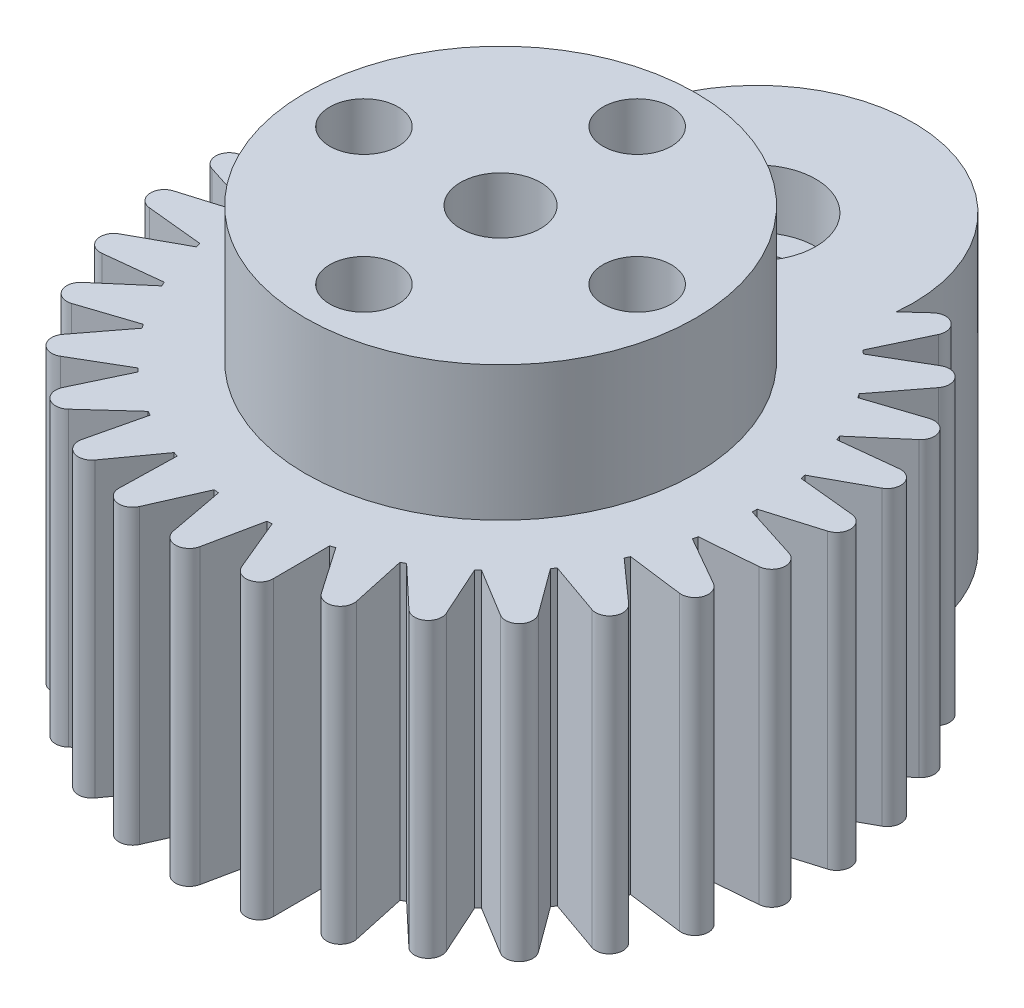
from build123d import *

# Parameters (mm, degrees)
SKETCH_1_R          = 2.05
SKETCH_1_R_2        = 1.75
EXTRUDE_1_DEPTH     = 15
SKETCH_2_R          = 10
SKETCH_2_R_2        = 1.75
SKETCH_2_R_3        = 2.05
EXTRUDE_2_DEPTH     = 6.9
SKETCH_3_R          = 8
SKETCH_3_R_2        = 1.75
EXTRUDE_3_DEPTH     = 15
CUT_EXTRUDE_1_DEPTH = 7.5
SKETCH_5_R          = 1.65
CUT_EXTRUDE_2_DEPTH = 7.5
SKETCH_6_R          = 3
CUT_EXTRUDE_3_DEPTH = 3


with BuildPart() as part:
    # 草图1 → 凸台-拉伸1 (new body)
    with BuildSketch(Plane(origin=(0, 0, 0), x_dir=(1, 0, 0), z_dir=(0, 1, 0))):
        with BuildLine():
            Line((13.15, 0), (15.928328767, 0.831197488))
            ThreePointArc((15.928328767, 0.831197488), (16.42452517, 1.568368494), (15.797783898, 2.198310824))
            Line((15.797783898, 2.198310824), (12.912357414, 2.48867957))
            ThreePointArc((12.912357414, 2.48867957), (12.888083079, 2.611477465), (12.86264095, 2.734038734))
            Line((12.86264095, 2.734038734), (15.407440892, 4.124719594))
            ThreePointArc((15.407440892, 4.124719594), (15.739527743, 4.948946678), (14.995509896, 5.43481642))
            Line((14.995509896, 5.43481642), (12.112765847, 5.118926013))
            ThreePointArc((12.112765847, 5.118926013), (12.063490846, 5.233993562), (12.013122768, 5.348586856))
            Line((12.013122768, 5.348586856), (14.213173917, 7.237971662))
            ThreePointArc((14.213173917, 7.237971662), (14.366637427, 8.113232145), (13.537860156, 8.433794459))
            Line((13.537860156, 8.433794459), (10.783788289, 7.525450826))
            ThreePointArc((10.783788289, 7.525450826), (10.711666177, 7.627759024), (10.638573476, 7.729376068))
            Line((10.638573476, 7.729376068), (12.397723039, 10.034889636))
            ThreePointArc((12.397723039, 10.034889636), (12.365856116, 10.922930435), (11.488540964, 11.06417521))
            Line((11.488540964, 11.06417521), (8.983507437, 9.603077326))
            ThreePointArc((8.983507437, 9.603077326), (8.891690295, 9.688154814), (8.799067474, 9.772354455))
            Line((8.799067474, 9.772354455), (10.040432174, 12.393234781))
            ThreePointArc((10.040432174, 12.393234781), (9.824627556, 13.255244252), (8.937117405, 13.210998413))
            Line((8.937117405, 13.210998413), (6.790604202, 11.261003267))
            ThreePointArc((6.790604202, 11.261003267), (6.68310488, 11.32513175), (6.575, 11.38823406))
            Line((6.575, 11.38823406), (7.244326243, 14.209936096))
            ThreePointArc((7.244326243, 14.209936096), (6.854015627, 15.008240289), (5.99509893, 14.780437591))
            Line((5.99509893, 14.780437591), (4.300918978, 12.426769329))
            ThreePointArc((4.300918978, 12.426769329), (4.182435713, 12.467146085), (4.063573476, 12.506393189))
            Line((4.063573476, 12.506393189), (4.131608494, 15.405595017))
            ThreePointArc((4.131608494, 15.405595017), (3.583850326, 16.105304208), (2.791065864, 15.703900723))
            Line((2.791065864, 15.703900723), (1.623262957, 13.04942594))
            ThreePointArc((1.623262957, 13.04942594), (1.498974036, 13.064286312), (1.374549292, 13.077962924))
            Line((1.374549292, 13.077962924), (0.838319627, 15.927955511))
            ThreePointArc((0.838319627, 15.927955511), (0.157053569, 16.498489051), (-0.534950174, 15.941028037))
            Line((-0.534950174, 15.941028037), (-1.125337445, 13.10176002))
            ThreePointArc((-1.125337445, 13.10176002), (-1.25, 13.090454538), (-1.374549292, 13.077962924))
            Line((-1.374549292, 13.077962924), (-2.49160783, 15.754187919))
            ThreePointArc((-2.49160783, 15.754187919), (-3.276607183, 16.170610754), (-3.837586321, 15.481455933))
            Line((-3.837586321, 15.481455933), (-3.8247552, 12.581484318))
            ThreePointArc((-3.8247552, 12.581484318), (-3.944343037, 12.544507085), (-4.063573476, 12.506393189))
            Line((-4.063573476, 12.506393189), (-5.712640068, 14.891886718))
            ThreePointArc((-5.712640068, 14.891886718), (-6.567064478, 15.135999172), (-6.972501532, 14.345269916))
            Line((-6.972501532, 14.345269916), (-6.3570128, 11.511337379))
            ThreePointArc((-6.3570128, 11.511337379), (-6.466299357, 11.450304477), (-6.575, 11.38823406))
            Line((-6.575, 11.38823406), (-8.684002523, 13.378738608))
            ThreePointArc((-8.684002523, 13.378738608), (-9.570509543, 13.439871795), (-9.802684968, 12.582126767))
            Line((-9.802684968, 12.582126767), (-8.611438437, 9.938089759))
            ThreePointArc((-8.611438437, 9.938089759), (-8.705647366, 9.85566862), (-8.799067474, 9.772354455))
            Line((-8.799067474, 9.772354455), (-11.275832398, 11.280875422))
            ThreePointArc((-11.275832398, 11.280875422), (-12.155677416, 11.15635753), (-12.204444033, 10.269084303))
            Line((-12.204444033, 10.269084303), (-10.489502891, 7.930499928))
            ThreePointArc((-10.489502891, 7.930499928), (-10.564516811, 7.83029275), (-10.638573476, 7.729376068))
            Line((-10.638573476, 7.729376068), (-13.374854289, 8.689983849))
            ThreePointArc((-13.374854289, 8.689983849), (-14.209583858, 8.385256906), (-14.072810329, 7.507233578))
            Line((-14.072810329, 7.507233578), (-11.909125735, 5.576309195))
            ThreePointArc((-11.909125735, 5.576309195), (-11.961666177, 5.462695514), (-12.013122768, 5.348586856))
            Line((-12.013122768, 5.348586856), (-14.889330869, 5.719298283))
            ThreePointArc((-14.889330869, 5.719298283), (-15.642463299, 5.247680319), (-15.326127286, 4.417280723))
            Line((-15.326127286, 4.417280723), (-12.808262637, 2.978406992))
            ThreePointArc((-12.808262637, 2.978406992), (-12.836033332, 2.856352271), (-12.86264095, 2.734038734))
            Line((-12.86264095, 2.734038734), (-15.753072242, 2.498651937))
            ThreePointArc((-15.753072242, 2.498651937), (-16.391692033, 1.88075492), (-15.909618937, 1.134271503))
            Line((-15.909618937, 1.134271503), (-13.147617002, 0.250334112))
            ThreePointArc((-13.147617002, 0.250334112), (-13.149404237, 0.125172727), (-13.15, 0))
            Line((-13.15, 0), (-15.928328767, -0.831197488))
            ThreePointArc((-15.928328767, -0.831197488), (-16.42452517, -1.568368494), (-15.797783898, -2.198310824))
            Line((-15.797783898, -2.198310824), (-12.912357414, -2.48867957))
            ThreePointArc((-12.912357414, -2.48867957), (-12.888083079, -2.611477465), (-12.86264095, -2.734038734))
            Line((-12.86264095, -2.734038734), (-15.407440892, -4.124719594))
            ThreePointArc((-15.407440892, -4.124719594), (-15.739527743, -4.948946678), (-14.995509896, -5.43481642))
            Line((-14.995509896, -5.43481642), (-12.112765847, -5.118926013))
            ThreePointArc((-12.112765847, -5.118926013), (-12.063490846, -5.233993562), (-12.013122768, -5.348586856))
            Line((-12.013122768, -5.348586856), (-14.213173917, -7.237971662))
            ThreePointArc((-14.213173917, -7.237971662), (-14.366637427, -8.113232145), (-13.537860156, -8.433794459))
            Line((-13.537860156, -8.433794459), (-10.783788289, -7.525450826))
            ThreePointArc((-10.783788289, -7.525450826), (-10.711666177, -7.627759024), (-10.638573476, -7.729376068))
            Line((-10.638573476, -7.729376068), (-12.397723039, -10.034889636))
            ThreePointArc((-12.397723039, -10.034889636), (-12.365856116, -10.922930435), (-11.488540964, -11.06417521))
            Line((-11.488540964, -11.06417521), (-8.983507437, -9.603077326))
            ThreePointArc((-8.983507437, -9.603077326), (-8.891690295, -9.688154814), (-8.799067474, -9.772354455))
            Line((-8.799067474, -9.772354455), (-10.040432174, -12.393234781))
            ThreePointArc((-10.040432174, -12.393234781), (-9.824627556, -13.255244252), (-8.937117405, -13.210998413))
            Line((-8.937117405, -13.210998413), (-6.790604202, -11.261003267))
            ThreePointArc((-6.790604202, -11.261003267), (-6.68310488, -11.32513175), (-6.575, -11.38823406))
            Line((-6.575, -11.38823406), (-7.244326243, -14.209936096))
            ThreePointArc((-7.244326243, -14.209936096), (-6.854015627, -15.008240289), (-5.99509893, -14.780437591))
            Line((-5.99509893, -14.780437591), (-4.300918978, -12.426769329))
            ThreePointArc((-4.300918978, -12.426769329), (-4.182435713, -12.467146085), (-4.063573476, -12.506393189))
            Line((-4.063573476, -12.506393189), (-4.131608494, -15.405595017))
            ThreePointArc((-4.131608494, -15.405595017), (-3.583850326, -16.105304208), (-2.791065864, -15.703900723))
            Line((-2.791065864, -15.703900723), (-1.623262957, -13.04942594))
            ThreePointArc((-1.623262957, -13.04942594), (-1.498974036, -13.064286312), (-1.374549292, -13.077962924))
            Line((-1.374549292, -13.077962924), (-0.838319627, -15.927955511))
            ThreePointArc((-0.838319627, -15.927955511), (-0.157053569, -16.498489051), (0.534950174, -15.941028037))
            Line((0.534950174, -15.941028037), (1.125337445, -13.10176002))
            ThreePointArc((1.125337445, -13.10176002), (1.25, -13.090454538), (1.374549292, -13.077962924))
            Line((1.374549292, -13.077962924), (2.49160783, -15.754187919))
            ThreePointArc((2.49160783, -15.754187919), (3.276607183, -16.170610754), (3.837586321, -15.481455933))
            Line((3.837586321, -15.481455933), (3.8247552, -12.581484318))
            ThreePointArc((3.8247552, -12.581484318), (3.944343037, -12.544507085), (4.063573476, -12.506393189))
            Line((4.063573476, -12.506393189), (5.712640068, -14.891886718))
            ThreePointArc((5.712640068, -14.891886718), (6.567064478, -15.135999172), (6.972501532, -14.345269916))
            Line((6.972501532, -14.345269916), (6.3570128, -11.511337379))
            ThreePointArc((6.3570128, -11.511337379), (6.466299357, -11.450304477), (6.575, -11.38823406))
            Line((6.575, -11.38823406), (8.684002523, -13.378738608))
            ThreePointArc((8.684002523, -13.378738608), (9.570509543, -13.439871795), (9.802684968, -12.582126767))
            Line((9.802684968, -12.582126767), (8.611438437, -9.938089759))
            ThreePointArc((8.611438437, -9.938089759), (8.705647366, -9.85566862), (8.799067474, -9.772354455))
            Line((8.799067474, -9.772354455), (11.275832398, -11.280875422))
            ThreePointArc((11.275832398, -11.280875422), (12.155677416, -11.15635753), (12.204444033, -10.269084303))
            Line((12.204444033, -10.269084303), (10.489502891, -7.930499928))
            ThreePointArc((10.489502891, -7.930499928), (10.564516811, -7.83029275), (10.638573476, -7.729376068))
            Line((10.638573476, -7.729376068), (13.374854289, -8.689983849))
            ThreePointArc((13.374854289, -8.689983849), (14.209583858, -8.385256906), (14.072810329, -7.507233578))
            Line((14.072810329, -7.507233578), (11.909125735, -5.576309195))
            ThreePointArc((11.909125735, -5.576309195), (11.961666177, -5.462695514), (12.013122768, -5.348586856))
            Line((12.013122768, -5.348586856), (14.889330869, -5.719298283))
            ThreePointArc((14.889330869, -5.719298283), (15.642463299, -5.247680319), (15.326127286, -4.417280723))
            Line((15.326127286, -4.417280723), (12.808262637, -2.978406992))
            ThreePointArc((12.808262637, -2.978406992), (12.836033332, -2.856352271), (12.86264095, -2.734038734))
            Line((12.86264095, -2.734038734), (15.753072242, -2.498651937))
            ThreePointArc((15.753072242, -2.498651937), (16.391692033, -1.88075492), (15.909618937, -1.134271503))
            Line((15.909618937, -1.134271503), (13.147617002, -0.250334112))
            ThreePointArc((13.147617002, -0.250334112), (13.149404237, -0.125172727), (13.15, 0))
        make_face()
        with Locations(Location((0, 0, 0), (0, 0, 270))):
            Circle(SKETCH_1_R, mode=Mode.SUBTRACT)
        with Locations(Location((0, 7, 0), (0, 0, 270))):
            Circle(SKETCH_1_R_2, mode=Mode.SUBTRACT)
        with Locations(Location((7, 0, 0), (0, 0, 270))):
            Circle(SKETCH_1_R_2, mode=Mode.SUBTRACT)
        with Locations(Location((0, -7, 0), (0, 0, 270))):
            Circle(SKETCH_1_R_2, mode=Mode.SUBTRACT)
        with Locations(Location((-7, 0, 0), (0, 0, 270))):
            Circle(SKETCH_1_R_2, mode=Mode.SUBTRACT)
    extrude(amount=EXTRUDE_1_DEPTH)

    # 草图2 → 凸台-拉伸2 (add)
    with BuildSketch(Plane(origin=(0, 15, 0), x_dir=(1, 0, 0), z_dir=(0, 1, 0))):
        with Locations(Location((0, 0, 0), (0, 0, 90))):
            Circle(SKETCH_2_R)
        with Locations(Location((0, -7, 0), (0, 0, 270))):
            Circle(SKETCH_2_R_2, mode=Mode.SUBTRACT)
        with Locations(Location((7, 0, 0), (0, 0, 270))):
            Circle(SKETCH_2_R_2, mode=Mode.SUBTRACT)
        with Locations(Location((0, 7, 0), (0, 0, 270))):
            Circle(SKETCH_2_R_2, mode=Mode.SUBTRACT)
        with Locations(Location((0, 0, 0), (0, 0, 270))):
            Circle(SKETCH_2_R_3, mode=Mode.SUBTRACT)
        with Locations(Location((-7, 0, 0), (0, 0, 270))):
            Circle(SKETCH_2_R_2, mode=Mode.SUBTRACT)
    extrude(amount=EXTRUDE_2_DEPTH)

    # 草图3 → 凸台-拉伸3 (add)
    with BuildSketch(Plane.XZ):
        with Locations((0, -13.15)):
            Circle(SKETCH_3_R)
        with Locations(Location((0, -7, 0), (0, 0, 90))):
            Circle(SKETCH_3_R_2, mode=Mode.SUBTRACT)
    extrude(amount=-EXTRUDE_3_DEPTH)

    # 草图4 → 切除-拉伸1 (cut)
    with BuildSketch(Plane.XZ):
        with BuildLine():
            Line((-3, -16.504101966), (-3, -20.566198487))
            ThreePointArc((-3, -20.566198487), (0, -21.15), (3, -20.566198487))
            Line((3, -20.566198487), (3, -16.504101966))
            ThreePointArc((3, -16.504101966), (0, -8.65), (-3, -16.504101966))
        make_face()
    extrude(amount=-CUT_EXTRUDE_1_DEPTH, mode=Mode.SUBTRACT)

    # 草图5 → 切除-拉伸2 (cut)
    with BuildSketch(Plane.XZ.offset(-7.5)):
        with Locations(Location((0, -13.15, 0), (0, 0, 270))):
            Circle(SKETCH_5_R)
    extrude(amount=-CUT_EXTRUDE_2_DEPTH, mode=Mode.SUBTRACT)

    # 草图6 → 切除-拉伸3 (cut)
    with BuildSketch(Plane(origin=(0, 15, 0), x_dir=(1, 0, 0), z_dir=(0, 1, 0))):
        with Locations(Location((0, 13.15, 0), (0, 0, 270))):
            Circle(SKETCH_6_R)
    extrude(amount=-CUT_EXTRUDE_3_DEPTH, mode=Mode.SUBTRACT)


solid = part.part
